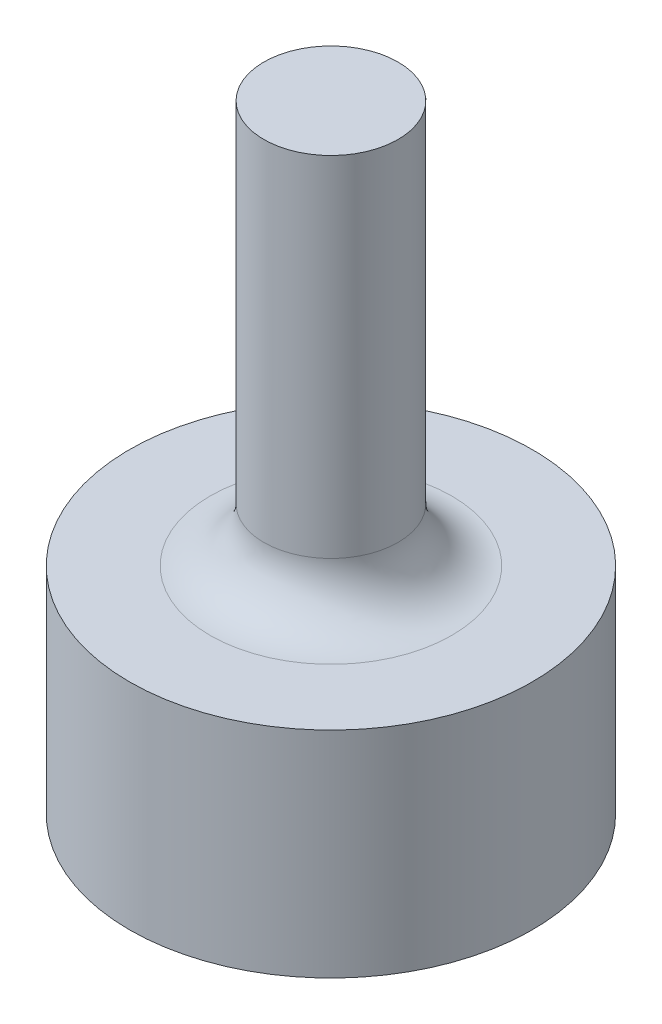
from build123d import *

# Parameters (mm, degrees)
SKETCH1_R           = 9.525
BOSS_EXTRUDE1_DEPTH = 10.16
SKETCH2_R           = 7.9375
CUT_EXTRUDE1_DEPTH  = 3.175
SKETCH3_R           = 3.175
BOSS_EXTRUDE2_DEPTH = 19.05
FILLET1_R           = 2.54


with BuildPart() as part:
    # Sketch1 → Boss-Extrude1 (new body)
    with BuildSketch(Plane(origin=(0, 0, 0), x_dir=(1, 0, 0), z_dir=(0, 1, 0))):
        with Locations(Location((0, 0, 0), (0, 0, 270))):
            Circle(SKETCH1_R)
    extrude(amount=BOSS_EXTRUDE1_DEPTH)

    # Sketch2 → Cut-Extrude1 (cut)
    with BuildSketch(Plane(origin=(0, 0, 0), x_dir=(-1, 0, 0), z_dir=(0, -1, 0))):
        with Locations(Location((0, 0, 0), (0, 0, 90))):
            Circle(SKETCH2_R)
    extrude(amount=-CUT_EXTRUDE1_DEPTH, mode=Mode.SUBTRACT)

    # Sketch3 → Boss-Extrude2 (add)
    with BuildSketch(Plane(origin=(0, 10.16, 0), x_dir=(1, 0, 0), z_dir=(0, 1, 0))):
        with Locations(Location((0, 0, 0), (0, 0, 90))):
            Circle(SKETCH3_R)
    extrude(amount=BOSS_EXTRUDE2_DEPTH)

    # Fillet1
    fillet1_edges = [part.edges().sort_by_distance(p)[0] for p in [
        (0, 10.16, 3.175),
    ]]
    fillet(fillet1_edges, radius=FILLET1_R)


solid = part.part
